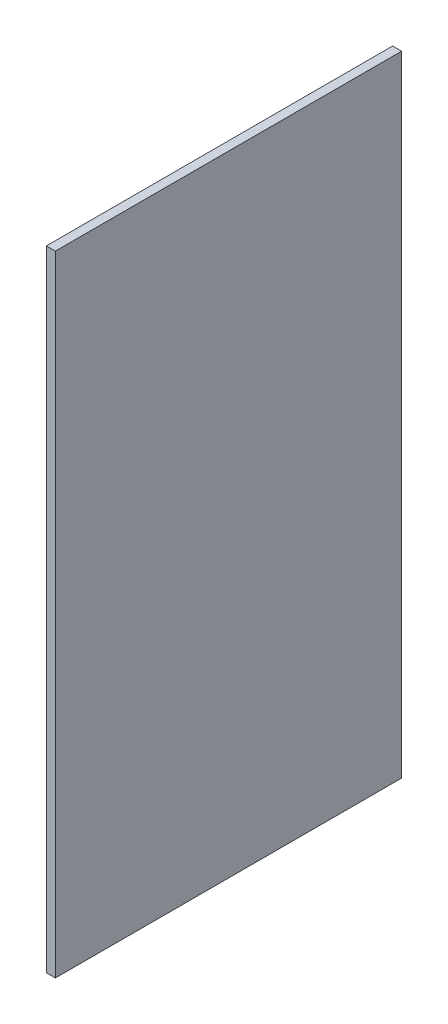
from build123d import *

# Parameters (mm, degrees)
SKETCH1_W           = 154
SKETCH1_H           = 280
BOSS_EXTRUDE1_DEPTH = 4


with BuildPart() as part:
    # Sketch1 → Boss-Extrude1 (new body)
    with BuildSketch(Plane(origin=(0, 0, 0), x_dir=(0, 0, -1), z_dir=(1, 0, 0))):
        with Locations((77, 140)):
            Rectangle(SKETCH1_W, SKETCH1_H)
    extrude(amount=BOSS_EXTRUDE1_DEPTH)


solid = part.part
